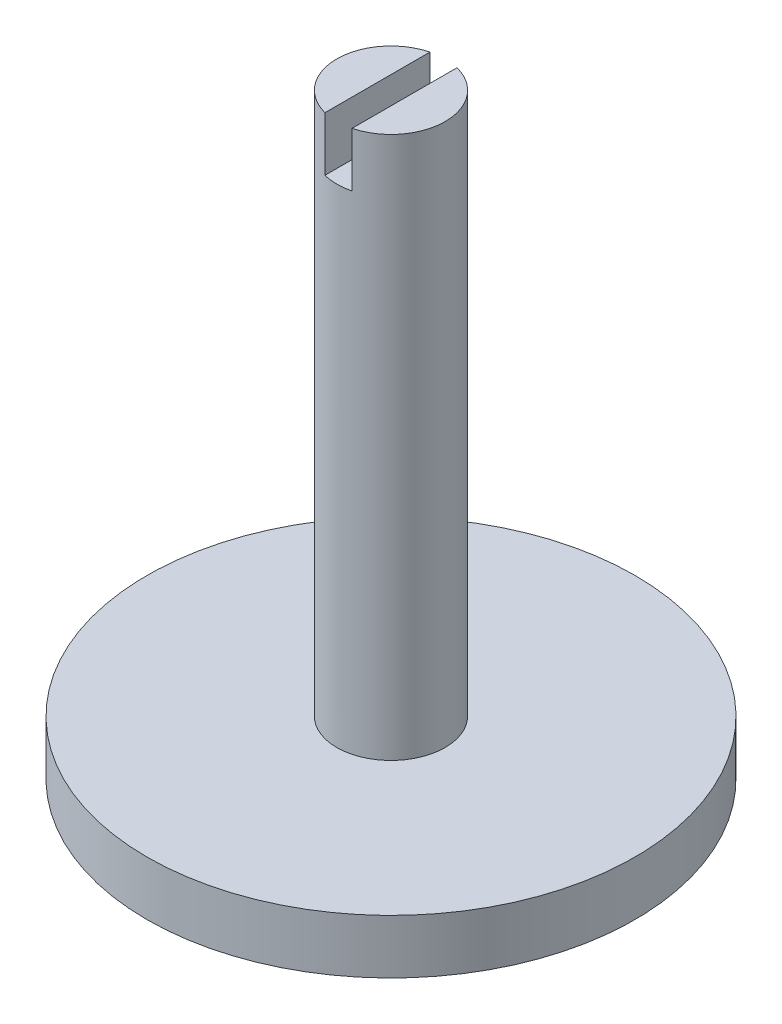
from build123d import *

# Parameters (mm, degrees)
SKETCH2_R                        = 57.15
BOSS_EXTRUDE1_DEPTH              = 12.7
SKETCH3_R                        = 12.7
BOSS_EXTRUDE2_DEPTH              = 127
CUT_EXTRUDE1_DEPTH               = 162.394965845
CUT_EXTRUDE1_DEPTH_BACK          = 162.394965845
SKETCH4_W                        = 6.35
SKETCH4_H                        = 12.7
F_5_8_0_341_DIAMETER_HOLE1_D     = 8.6614
F_5_8_0_341_DIAMETER_HOLE1_DEPTH = 22.797852917
F_5_8_0_341_DIAMETER_HOLE1_TIP   = 2.602147083


with BuildPart() as part:
    # Sketch2 → Boss-Extrude1 (new body)
    with BuildSketch(Plane(origin=(0, 0, 0), x_dir=(1, 0, 0), z_dir=(0, 1, 0))):
        with Locations(Location((0, 0, 0), (0, 0, 270))):
            Circle(SKETCH2_R)
    extrude(amount=BOSS_EXTRUDE1_DEPTH)

    # Sketch3 → Boss-Extrude2 (add)
    with BuildSketch(Plane(origin=(0, 12.7, 0), x_dir=(1, 0, 0), z_dir=(0, 1, 0))):
        with Locations(Location((0, 0, 0), (0, 0, 270))):
            Circle(SKETCH3_R)
    extrude(amount=BOSS_EXTRUDE2_DEPTH)

    # Sketch4 → Cut-Extrude1 (cut, two sides: drawn at the far end of the back side and taken through both)
    with BuildSketch(Plane.XY.offset(-CUT_EXTRUDE1_DEPTH_BACK)):
        with Locations((0, 133.35)):
            Rectangle(SKETCH4_W, SKETCH4_H)
    extrude(amount=CUT_EXTRUDE1_DEPTH + CUT_EXTRUDE1_DEPTH_BACK, mode=Mode.SUBTRACT)

    # 5/8 (0.341) Diameter Hole1
    with Locations(Plane(origin=(0, 0, 0), x_dir=(-1, 0, 0), z_dir=(0, -1, 0))):
        with Locations((0, 0)):
            Hole(F_5_8_0_341_DIAMETER_HOLE1_D / 2, depth=F_5_8_0_341_DIAMETER_HOLE1_DEPTH)
            with Locations((0, 0, -(F_5_8_0_341_DIAMETER_HOLE1_DEPTH + F_5_8_0_341_DIAMETER_HOLE1_TIP / 2))):  # 118° drill point
                Cone(0, F_5_8_0_341_DIAMETER_HOLE1_D / 2, F_5_8_0_341_DIAMETER_HOLE1_TIP, mode=Mode.SUBTRACT)


solid = part.part
